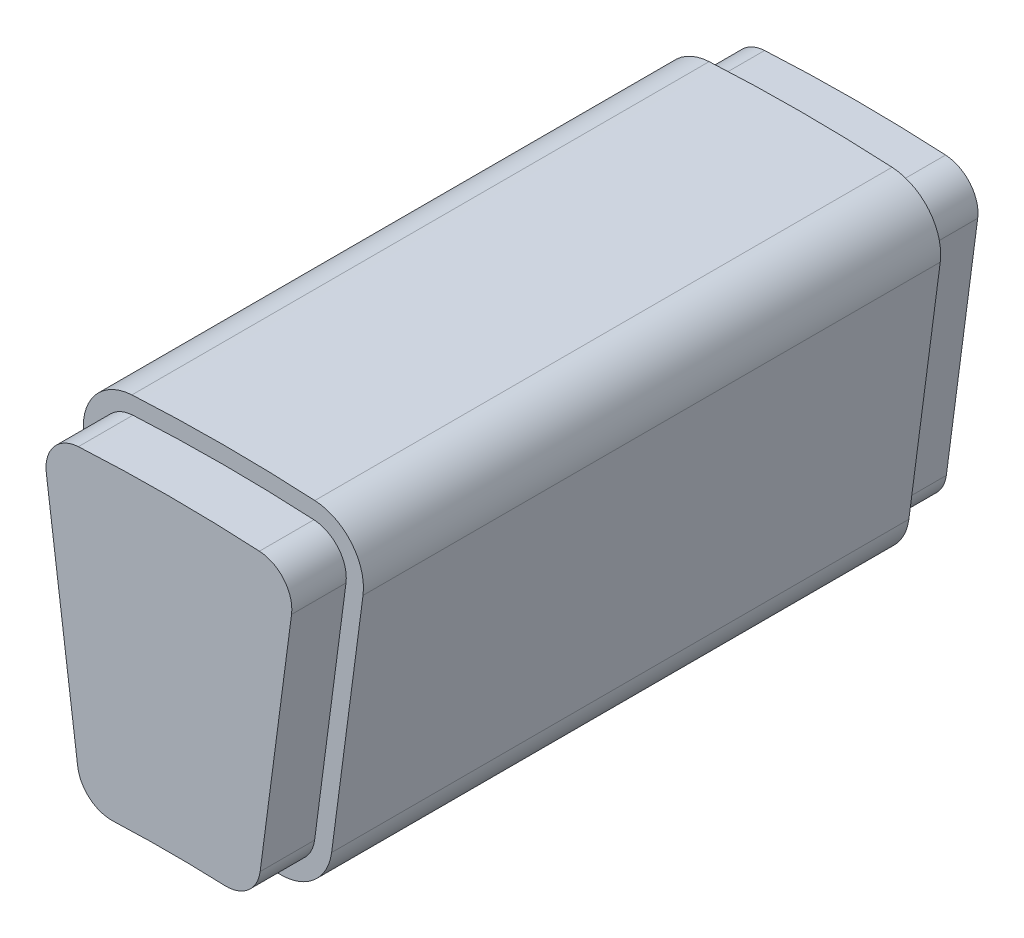
from build123d import *

# Parameters (mm, degrees)
BOSS_EXTRUDE1_DEPTH      = 36.825
BOSS_EXTRUDE1_DEPTH_BACK = 3.175
BOSS_EXTRUDE2_DEPTH      = 33.65


with BuildPart() as part:
    # Sketch1 → Boss-Extrude1 (new, two sides: drawn at the far end of the back side and taken through both)
    with BuildSketch(Plane.XY.offset(-BOSS_EXTRUDE1_DEPTH_BACK)):
        with BuildLine():
            Line((5.318680122, 78.705874291), (7.148138473, 92.601990083))
            ThreePointArc((7.148138473, 92.601990083), (6.704979898, 94.139454624), (5.276321506, 94.859955796))
            ThreePointArc((5.276321506, 94.859955796), (0, 95.006582836), (-5.276321506, 94.859955796))
            ThreePointArc((-5.276321506, 94.859955796), (-6.704979898, 94.139454624), (-7.148138473, 92.601990083))
            Line((-7.148138473, 92.601990083), (-5.318680122, 78.705874291))
            ThreePointArc((-5.318680122, 78.705874291), (-4.622449596, 77.435748007), (-3.25137992, 76.968708751))
            ThreePointArc((-3.25137992, 76.968708751), (0, 77.037351968), (3.25137992, 76.968708751))
            ThreePointArc((3.25137992, 76.968708751), (4.622449596, 77.435748007), (5.318680122, 78.705874291))
        make_face()
    extrude(amount=BOSS_EXTRUDE1_DEPTH + BOSS_EXTRUDE1_DEPTH_BACK)

    # Sketch2 → Boss-Extrude2 (add)
    with BuildSketch(Plane.XY):
        with BuildLine():
            Line((6.310124984, 78.575348099), (8.139583334, 92.47146389))
            ThreePointArc((8.139583334, 92.47146389), (7.474845471, 94.777660702), (5.331857885, 95.85841246))
            ThreePointArc((5.331857885, 95.85841246), (0, 96.006582836), (-5.331857885, 95.85841246))
            ThreePointArc((-5.331857885, 95.85841246), (-7.474845471, 94.777660702), (-8.139583334, 92.47146389))
            Line((-8.139583334, 92.47146389), (-6.310124984, 78.575348099))
            ThreePointArc((-6.310124984, 78.575348099), (-5.265779194, 76.670158673), (-3.20917468, 75.96959979))
            ThreePointArc((-3.20917468, 75.96959979), (0, 76.037351968), (3.20917468, 75.96959979))
            ThreePointArc((3.20917468, 75.96959979), (5.265779194, 76.670158673), (6.310124984, 78.575348099))
        make_face()
    extrude(amount=BOSS_EXTRUDE2_DEPTH)


solid = part.part
